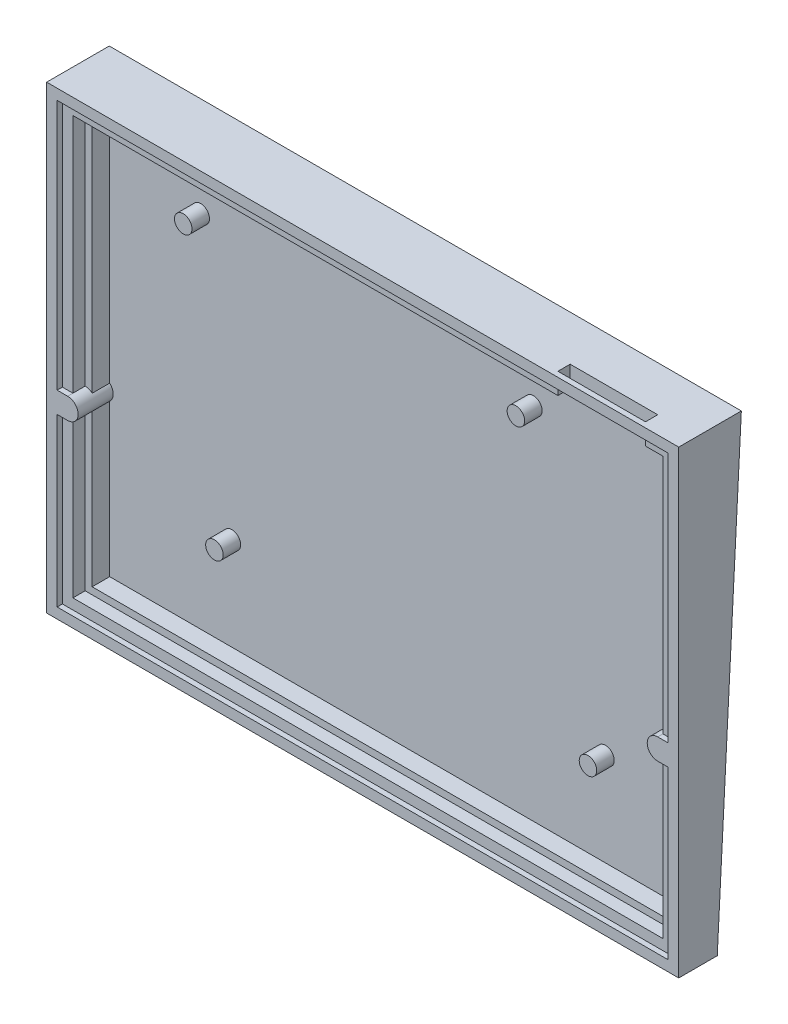
from build123d import *

# Parameters (mm, degrees)
EXTRUDE_3_DEPTH     = 8.5
EXTRUDE_3_2_DEPTH   = 8.5
SKETCH_4_W          = 180.5019154
SKETCH_4_H          = 131.300307
EXTRUDE_5_DEPTH     = 10
EXTRUDE_6_DEPTH     = 5
SKETCH_8_W          = 25
SKETCH_8_H          = 6
CUT_EXTRUDE_1_DEPTH = 3.5
SKETCH_9_R          = 2.5
EXTRUDE_7_DEPTH     = 5
EXTRUDE_7_2_DEPTH   = 5
EXTRUDE_7_3_DEPTH   = 5
EXTRUDE_7_4_DEPTH   = 5
EXTRUDE_8_DEPTH     = 180.5019154


with BuildPart() as part:
    # Model → 凸台-拉伸3 (new body)
    with BuildSketch(Plane.XY):
        Polygon((565.397621393, -28.479593633), (562.397621393, -28.479593633), (562.397621393, -73.105300633), (393.895705993, -73.105300633), (393.895705993, -28.478893633), (390.895705993, -28.478893633), (390.895705993, -76.105300633), (565.397621393, -76.105300633), align=None)
    extrude(amount=EXTRUDE_3_DEPTH)



with BuildPart() as body_2:
    # Model → Extrude 3 2 (new body)
    with BuildSketch(Plane.XY):
        Polygon((393.895705993, -22.478893633), (393.895705993, 46.195006367), (562.397621393, 46.195006367), (562.397621393, -22.479593633), (565.397621393, -22.479593633), (565.397621393, 49.195006367), (390.895705993, 49.195006367), (390.895705993, -22.478893633), align=None)
    extrude(amount=EXTRUDE_3_2_DEPTH)


with BuildPart() as part_1:
    add(part.part)

    add(body_2.part)  # 凸台-拉伸5 merges body 2
    # 草图4 → 凸台-拉伸5 (add)
    with BuildSketch(Plane(origin=(0, 0, 0), x_dir=(-1, 0, 0), z_dir=(0, 0, -1))):
        with Locations((-478.146663693, -13.455147133)):
            Rectangle(SKETCH_4_W, SKETCH_4_H)
        with BuildLine():
            ThreePointArc((-562.397621393, -28.479593633), (-559.397621393, -25.479593633), (-562.397621393, -22.479593633))
            Line((-562.397621393, -22.479593633), (-565.397621393, -22.479593633))
            Line((-565.397621393, -22.479593633), (-565.397621393, 49.195006367))
            Line((-565.397621393, 49.195006367), (-390.895705993, 49.195006367))
            Line((-390.895705993, 49.195006367), (-390.895705993, -22.478893633))
            Line((-390.895705993, -22.478893633), (-393.895705993, -22.478893633))
            ThreePointArc((-393.895705993, -22.478893633), (-396.895705993, -25.478893633), (-393.895705993, -28.478893633))
            Line((-393.895705993, -28.478893633), (-390.895705993, -28.478893633))
            Line((-390.895705993, -28.478893633), (-390.895705993, -76.105300633))
            Line((-390.895705993, -76.105300633), (-565.397621393, -76.105300633))
            Line((-565.397621393, -76.105300633), (-565.397621393, -28.479593633))
            Line((-565.397621393, -28.479593633), (-562.397621393, -28.479593633))
        make_face(mode=Mode.SUBTRACT)
    extrude(amount=-EXTRUDE_5_DEPTH)

    # 草图5 → 凸台-拉伸6 (add)
    with BuildSketch(Plane(origin=(0, 0, 0), x_dir=(-1, 0, 0), z_dir=(0, 0, -1))):
        with BuildLine():
            Line((-562.397621393, 46.195006367), (-562.397621393, -22.479593633))
            ThreePointArc((-562.397621393, -22.479593633), (-561.327155124, -22.677076556), (-560.397621393, -23.243525656))
            Line((-560.397621393, -23.243525656), (-560.397621393, 44.195006367))
            Line((-560.397621393, 44.195006367), (-395.895705993, 44.195006367))
            Line((-395.895705993, 44.195006367), (-395.895705993, -23.242825656))
            ThreePointArc((-395.895705993, -23.242825656), (-394.966172262, -22.676376556), (-393.895705993, -22.478893633))
            Line((-393.895705993, -22.478893633), (-393.895705993, 46.195006367))
            Line((-393.895705993, 46.195006367), (-562.397621393, 46.195006367))
        make_face()
        with BuildLine():
            Line((-560.397621393, -71.105300633), (-560.397621393, -27.715661611))
            ThreePointArc((-560.397621393, -27.715661611), (-561.327155124, -28.28211071), (-562.397621393, -28.479593633))
            Line((-562.397621393, -28.479593633), (-562.397621393, -73.105300633))
            Line((-562.397621393, -73.105300633), (-393.895705993, -73.105300633))
            Line((-393.895705993, -73.105300633), (-393.895705993, -28.478893633))
            ThreePointArc((-393.895705993, -28.478893633), (-394.966172262, -28.28141071), (-395.895705993, -27.714961611))
            Line((-395.895705993, -27.714961611), (-395.895705993, -71.105300633))
            Line((-395.895705993, -71.105300633), (-560.397621393, -71.105300633))
        make_face()
    extrude(amount=-EXTRUDE_6_DEPTH)

    # 草图8 → 切除-拉伸1 (cut)
    with BuildSketch(Plane.XY.offset(5)):
        with Locations((544.897621393, 49.195006367)):
            Rectangle(SKETCH_8_W, SKETCH_8_H)
    extrude(amount=CUT_EXTRUDE_1_DEPTH, mode=Mode.SUBTRACT)



with BuildPart() as body_2_2:
    # 草图9 → 凸台-拉伸7 (new body)
    with BuildSketch(Plane(origin=(0, 0, 0), x_dir=(-1, 0, 0), z_dir=(0, 0, -1))):
        with Locations((-430.805705993, -44.525300633)):
            Circle(SKETCH_9_R)
    extrude(amount=-EXTRUDE_7_DEPTH)


with BuildPart() as body_3:
    # 草图9 → Extrude 7 2 (new body)
    with BuildSketch(Plane(origin=(0, 0, 0), x_dir=(-1, 0, 0), z_dir=(0, 0, -1))):
        with Locations((-537.477621393, -44.525300633)):
            Circle(SKETCH_9_R)
    extrude(amount=-EXTRUDE_7_2_DEPTH)


with BuildPart() as body_4:
    # 草图9 → Extrude 7 3 (new body)
    with BuildSketch(Plane(origin=(0, 0, 0), x_dir=(-1, 0, 0), z_dir=(0, 0, -1))):
        with Locations((-421.895705993, 31.665006367)):
            Circle(SKETCH_9_R)
    extrude(amount=-EXTRUDE_7_3_DEPTH)


with BuildPart() as body_5:
    # 草图9 → Extrude 7 4 (new body)
    with BuildSketch(Plane(origin=(0, 0, 0), x_dir=(-1, 0, 0), z_dir=(0, 0, -1))):
        with Locations((-516.895705993, 31.665006367)):
            Circle(SKETCH_9_R)
    extrude(amount=-EXTRUDE_7_4_DEPTH)


with BuildPart() as part_2:
    add(part_1.part)

    add(body_2_2.part)  # 凸台-拉伸8 merges body 2 2

    add(body_3.part)  # 凸台-拉伸8 merges body 3

    add(body_4.part)  # 凸台-拉伸8 merges body 4

    add(body_5.part)  # 凸台-拉伸8 merges body 5
    # 草图10 → 凸台-拉伸8 (add)
    with BuildSketch(Plane.ZY.offset(-387.895705993)):
        Polygon((-1, -79.105300633), (-7.881157509, 52.195006367), (0, 52.195006367), (0, -79.105300633), align=None)
    extrude(amount=-EXTRUDE_8_DEPTH)


solid = part_2.part
